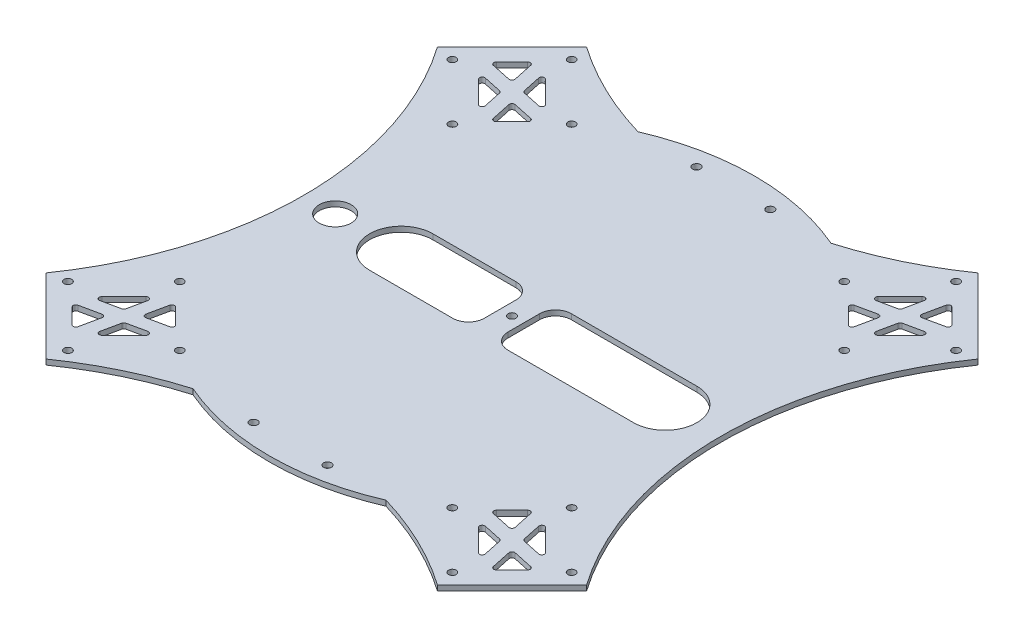
from build123d import *

# Parameters (mm, degrees)
EXTRUDE_1_DEPTH          = 2
HOLE_WIZARD_1_D          = 2.9
HOLE_WIZARD_1_DEPTH      = 100
CUT_EXTRUDE_2_DEPTH      = 146.013792447
CUT_EXTRUDE_2_DEPTH_BACK = 146.013792447
CUT_EXTRUDE_3_DEPTH      = 146.013792447
CUT_EXTRUDE_3_DEPTH_BACK = 146.013792447
SKETCH_8_R               = 129.444320441
CUT_EXTRUDE_4_DEPTH      = 146.013792447
CUT_EXTRUDE_4_DEPTH_BACK = 146.013792447
SKETCH_9_R               = 6.05
EXTRUDE_3_DEPTH          = 2
HOLE_WIZARD_2_D          = 3
HOLE_WIZARD_2_DEPTH      = 100
CUT_EXTRUDE_5_DEPTH      = 146.013792447
CUT_EXTRUDE_5_DEPTH_BACK = 146.013792447
SKETCH_18_R              = 1.5


with BuildPart() as part:
    # 草图1 → 凸台-拉伸1 (new body)
    with BuildSketch(Plane(origin=(0, 0, 0), x_dir=(1, 0, 0), z_dir=(0, 1, 0))):
        Polygon((-74.246212025, 102.530483272), (-102.530483272, 74.246212025), (-102.530483272, -74.246212025), (-74.246212025, -102.530483272), (74.246212025, -102.530483272), (102.530483272, -74.246212025), (102.530483272, 74.246212025), (74.246212025, 102.530483272), align=None)
    extrude(amount=EXTRUDE_1_DEPTH)

    # 孔1
    with Locations(Plane(origin=(0, 2, 0), x_dir=(1, 0, 0), z_dir=(0, 1, 0))):
        with Locations((-95.539712665, 72.915895741), (-74.326509229, 51.702692305), (-51.699092231, 74.330109303), (-72.912295667, 95.543312739), (72.915895741, 95.539712665), (51.702692305, 74.326509229), (74.330109303, 51.699092231), (95.543312739, 72.912295667), (95.539712665, -72.915895741), (74.326509229, -51.702692305), (51.699092231, -74.330109303), (72.912295667, -95.543312739), (-72.915895741, -95.539712665), (-51.702692305, -74.326509229), (-74.330109303, -51.699092231), (-95.543312739, -72.912295667)):
            Hole(HOLE_WIZARD_1_D / 2, depth=HOLE_WIZARD_1_DEPTH)

    # 草图7 → 切除-拉伸2 (cut, two sides: drawn at the far end of the back side and taken through both)
    with BuildSketch(Plane(origin=(0, 2, 0), x_dir=(1, 0, 0), z_dir=(0, 1, 0)).offset(-CUT_EXTRUDE_2_DEPTH_BACK)):
        with BuildLine():
            Line((-86.393024897, 80.484175463), (-80.480575389, 86.396624971))
            ThreePointArc((-80.480575389, 86.396624971), (-79.489849579, 86.64845523), (-78.795493206, 85.89823837))
            Line((-78.795493206, 85.89823837), (-77.191282416, 78.381578071))
            ThreePointArc((-77.191282416, 78.381578071), (-77.462151036, 77.46575111), (-78.377977997, 77.194882489))
            Line((-78.377977997, 77.194882489), (-85.894638296, 78.79909328))
            ThreePointArc((-85.894638296, 78.79909328), (-86.644855156, 79.493449653), (-86.393024897, 80.484175463))
        make_face()
        with BuildLine():
            Line((-84.160083838, 71.435761851), (-75.806643119, 63.082321131))
            ThreePointArc((-75.806643119, 63.082321131), (-74.622014392, 62.91080809), (-74.121560936, 63.998148093))
            Line((-74.121560936, 63.998148093), (-75.590793382, 70.882356366))
            ThreePointArc((-75.590793382, 70.882356366), (-75.861662002, 71.380742967), (-76.360048603, 71.651611588))
            Line((-76.360048603, 71.651611588), (-83.244256877, 73.120844034))
            ThreePointArc((-83.244256877, 73.120844034), (-84.331596879, 72.620390577), (-84.160083838, 71.435761851))
        make_face()
        with BuildLine():
            Line((-71.432161777, 84.163683912), (-63.078721058, 75.810243193))
            ThreePointArc((-63.078721058, 75.810243193), (-62.907208017, 74.625614466), (-63.994548019, 74.12516101))
            Line((-63.994548019, 74.12516101), (-70.878756293, 75.594393456))
            ThreePointArc((-70.878756293, 75.594393456), (-71.377142893, 75.865262076), (-71.648011514, 76.363648677))
            Line((-71.648011514, 76.363648677), (-73.11724396, 83.247856951))
            ThreePointArc((-73.11724396, 83.247856951), (-72.616790503, 84.335196953), (-71.432161777, 84.163683912))
        make_face()
        with BuildLine():
            Line((-66.758229507, 60.849380072), (-60.845779998, 66.761829581))
            ThreePointArc((-60.845779998, 66.761829581), (-60.59394974, 67.752555391), (-61.344166599, 68.446911764))
            Line((-61.344166599, 68.446911764), (-68.860826898, 70.051122554))
            ThreePointArc((-68.860826898, 70.051122554), (-69.77665386, 69.780253934), (-70.04752248, 68.864426972))
            Line((-70.04752248, 68.864426972), (-68.44331169, 61.347766673))
            ThreePointArc((-68.44331169, 61.347766673), (-67.748955317, 60.597549814), (-66.758229507, 60.849380072))
        make_face()
        with BuildLine():
            Line((80.484175463, 86.393024897), (86.396624971, 80.480575389))
            ThreePointArc((86.396624971, 80.480575389), (86.64845523, 79.489849579), (85.89823837, 78.795493206))
            Line((85.89823837, 78.795493206), (78.381578071, 77.191282416))
            ThreePointArc((78.381578071, 77.191282416), (77.46575111, 77.462151036), (77.194882489, 78.377977997))
            Line((77.194882489, 78.377977997), (78.79909328, 85.894638296))
            ThreePointArc((78.79909328, 85.894638296), (79.493449653, 86.644855156), (80.484175463, 86.393024897))
        make_face()
        with BuildLine():
            Line((71.435761851, 84.160083838), (63.082321131, 75.806643119))
            ThreePointArc((63.082321131, 75.806643119), (62.91080809, 74.622014392), (63.998148093, 74.121560936))
            Line((63.998148093, 74.121560936), (70.882356366, 75.590793382))
            ThreePointArc((70.882356366, 75.590793382), (71.380742967, 75.861662002), (71.651611588, 76.360048603))
            Line((71.651611588, 76.360048603), (73.120844034, 83.244256877))
            ThreePointArc((73.120844034, 83.244256877), (72.620390577, 84.331596879), (71.435761851, 84.160083838))
        make_face()
        with BuildLine():
            Line((84.163683912, 71.432161777), (75.810243193, 63.078721058))
            ThreePointArc((75.810243193, 63.078721058), (74.625614466, 62.907208017), (74.12516101, 63.994548019))
            Line((74.12516101, 63.994548019), (75.594393456, 70.878756293))
            ThreePointArc((75.594393456, 70.878756293), (75.865262076, 71.377142893), (76.363648677, 71.648011514))
            Line((76.363648677, 71.648011514), (83.247856951, 73.11724396))
            ThreePointArc((83.247856951, 73.11724396), (84.335196953, 72.616790503), (84.163683912, 71.432161777))
        make_face()
        with BuildLine():
            Line((60.849380072, 66.758229507), (66.761829581, 60.845779998))
            ThreePointArc((66.761829581, 60.845779998), (67.752555391, 60.59394974), (68.446911764, 61.344166599))
            Line((68.446911764, 61.344166599), (70.051122554, 68.860826898))
            ThreePointArc((70.051122554, 68.860826898), (69.780253934, 69.77665386), (68.864426972, 70.04752248))
            Line((68.864426972, 70.04752248), (61.347766673, 68.44331169))
            ThreePointArc((61.347766673, 68.44331169), (60.597549814, 67.748955317), (60.849380072, 66.758229507))
        make_face()
        with BuildLine():
            Line((86.393024897, -80.484175463), (80.480575389, -86.396624971))
            ThreePointArc((80.480575389, -86.396624971), (79.489849579, -86.64845523), (78.795493206, -85.89823837))
            Line((78.795493206, -85.89823837), (77.191282416, -78.381578071))
            ThreePointArc((77.191282416, -78.381578071), (77.462151036, -77.46575111), (78.377977997, -77.194882489))
            Line((78.377977997, -77.194882489), (85.894638296, -78.79909328))
            ThreePointArc((85.894638296, -78.79909328), (86.644855156, -79.493449653), (86.393024897, -80.484175463))
        make_face()
        with BuildLine():
            Line((84.160083838, -71.435761851), (75.806643119, -63.082321131))
            ThreePointArc((75.806643119, -63.082321131), (74.622014392, -62.91080809), (74.121560936, -63.998148093))
            Line((74.121560936, -63.998148093), (75.590793382, -70.882356366))
            ThreePointArc((75.590793382, -70.882356366), (75.861662002, -71.380742967), (76.360048603, -71.651611588))
            Line((76.360048603, -71.651611588), (83.244256877, -73.120844034))
            ThreePointArc((83.244256877, -73.120844034), (84.331596879, -72.620390577), (84.160083838, -71.435761851))
        make_face()
        with BuildLine():
            Line((71.432161777, -84.163683912), (63.078721058, -75.810243193))
            ThreePointArc((63.078721058, -75.810243193), (62.907208017, -74.625614466), (63.994548019, -74.12516101))
            Line((63.994548019, -74.12516101), (70.878756293, -75.594393456))
            ThreePointArc((70.878756293, -75.594393456), (71.377142893, -75.865262076), (71.648011514, -76.363648677))
            Line((71.648011514, -76.363648677), (73.11724396, -83.247856951))
            ThreePointArc((73.11724396, -83.247856951), (72.616790503, -84.335196953), (71.432161777, -84.163683912))
        make_face()
        with BuildLine():
            Line((66.758229507, -60.849380072), (60.845779998, -66.761829581))
            ThreePointArc((60.845779998, -66.761829581), (60.59394974, -67.752555391), (61.344166599, -68.446911764))
            Line((61.344166599, -68.446911764), (68.860826898, -70.051122554))
            ThreePointArc((68.860826898, -70.051122554), (69.77665386, -69.780253934), (70.04752248, -68.864426972))
            Line((70.04752248, -68.864426972), (68.44331169, -61.347766673))
            ThreePointArc((68.44331169, -61.347766673), (67.748955317, -60.597549814), (66.758229507, -60.849380072))
        make_face()
        with BuildLine():
            Line((-80.484175463, -86.393024897), (-86.396624971, -80.480575389))
            ThreePointArc((-86.396624971, -80.480575389), (-86.64845523, -79.489849579), (-85.89823837, -78.795493206))
            Line((-85.89823837, -78.795493206), (-78.381578071, -77.191282416))
            ThreePointArc((-78.381578071, -77.191282416), (-77.46575111, -77.462151036), (-77.194882489, -78.377977997))
            Line((-77.194882489, -78.377977997), (-78.79909328, -85.894638296))
            ThreePointArc((-78.79909328, -85.894638296), (-79.493449653, -86.644855156), (-80.484175463, -86.393024897))
        make_face()
        with BuildLine():
            Line((-71.435761851, -84.160083838), (-63.082321131, -75.806643119))
            ThreePointArc((-63.082321131, -75.806643119), (-62.91080809, -74.622014392), (-63.998148093, -74.121560936))
            Line((-63.998148093, -74.121560936), (-70.882356366, -75.590793382))
            ThreePointArc((-70.882356366, -75.590793382), (-71.380742967, -75.861662002), (-71.651611588, -76.360048603))
            Line((-71.651611588, -76.360048603), (-73.120844034, -83.244256877))
            ThreePointArc((-73.120844034, -83.244256877), (-72.620390577, -84.331596879), (-71.435761851, -84.160083838))
        make_face()
        with BuildLine():
            Line((-84.163683912, -71.432161777), (-75.810243193, -63.078721058))
            ThreePointArc((-75.810243193, -63.078721058), (-74.625614466, -62.907208017), (-74.12516101, -63.994548019))
            Line((-74.12516101, -63.994548019), (-75.594393456, -70.878756293))
            ThreePointArc((-75.594393456, -70.878756293), (-75.865262076, -71.377142893), (-76.363648677, -71.648011514))
            Line((-76.363648677, -71.648011514), (-83.247856951, -73.11724396))
            ThreePointArc((-83.247856951, -73.11724396), (-84.335196953, -72.616790503), (-84.163683912, -71.432161777))
        make_face()
        with BuildLine():
            Line((-60.849380072, -66.758229507), (-66.761829581, -60.845779998))
            ThreePointArc((-66.761829581, -60.845779998), (-67.752555391, -60.59394974), (-68.446911764, -61.344166599))
            Line((-68.446911764, -61.344166599), (-70.051122554, -68.860826898))
            ThreePointArc((-70.051122554, -68.860826898), (-69.780253934, -69.77665386), (-68.864426972, -70.04752248))
            Line((-68.864426972, -70.04752248), (-61.347766673, -68.44331169))
            ThreePointArc((-61.347766673, -68.44331169), (-60.597549814, -67.748955317), (-60.849380072, -66.758229507))
        make_face()
    extrude(amount=CUT_EXTRUDE_2_DEPTH + CUT_EXTRUDE_2_DEPTH_BACK, mode=Mode.SUBTRACT)

    # 草图8 → 切除-拉伸3 (cut, two sides: drawn at the far end of the back side and taken through both)
    with BuildSketch(Plane(origin=(0, 2, 0), x_dir=(1, 0, 0), z_dir=(0, 1, 0)).offset(-CUT_EXTRUDE_3_DEPTH_BACK)):
        with Locations((-208.565062983, 0)):
            Circle(SKETCH_8_R)
        with Locations((0, 208.565062983)):
            Circle(SKETCH_8_R)
        with Locations((208.565062983, 0)):
            Circle(SKETCH_8_R)
        with Locations((0, -208.565062983)):
            Circle(SKETCH_8_R)
    extrude(amount=CUT_EXTRUDE_3_DEPTH + CUT_EXTRUDE_3_DEPTH_BACK, mode=Mode.SUBTRACT)

    # 草图9 → 切除-拉伸4 (cut, two sides: drawn at the far end of the back side and taken through both)
    with BuildSketch(Plane(origin=(0, 2, 0), x_dir=(1, 0, 0), z_dir=(0, 1, 0)).offset(-CUT_EXTRUDE_4_DEPTH_BACK)):
        with Locations(Location((-67.070742542, 0, 0), (0, 0, 270))):
            Circle(SKETCH_9_R)
    extrude(amount=CUT_EXTRUDE_4_DEPTH + CUT_EXTRUDE_4_DEPTH_BACK, mode=Mode.SUBTRACT)

    # 草图15 → 凸台-拉伸3 (add)
    with BuildSketch(Plane(origin=(0, 2, 0), x_dir=(1, 0, 0), z_dir=(0, 1, 0))):
        with BuildLine():
            Line((-40.341181006, 82.683668974), (-31.918521189, 62.685196363))
            ThreePointArc((-31.918521189, 62.685196363), (2.489785707, 70.299550533), (36.273204046, 60.270063101))
            Line((36.273204046, 60.270063101), (44.635831637, 80.446519714))
            ThreePointArc((44.635831637, 80.446519714), (2.421201193, 91.968134616), (-40.341181006, 82.683668974))
        make_face()
        with BuildLine():
            Line((-42.42945176, -81.631743969), (-34.531619798, -61.284525552))
            ThreePointArc((-34.531619798, -61.284525552), (0.010434557, -70.343626073), (34.549799794, -61.274278226))
            Line((34.549799794, -61.274278226), (41.391005983, -82.163158555))
            ThreePointArc((41.391005983, -82.163158555), (-0.583260468, -91.998151108), (-42.42945176, -81.631743969))
        make_face()
    extrude(amount=-EXTRUDE_3_DEPTH)

    # 孔2
    with Locations(Plane(origin=(0, 2, 0), x_dir=(1, 0, 0), z_dir=(0, 1, 0))):
        with Locations((-14, 84), (14, 84), (-14, -84), (14, -84)):
            Hole(HOLE_WIZARD_2_D / 2, depth=HOLE_WIZARD_2_DEPTH)

    # 草图18 → 切除-拉伸5 (cut, two sides: drawn at the far end of the back side and taken through both)
    with BuildSketch(Plane(origin=(0, 2, 0), x_dir=(1, 0, 0), z_dir=(0, 1, 0)).offset(-CUT_EXTRUDE_5_DEPTH_BACK)):
        with Locations(Location((0, 0, 0), (0, 0, 270))):
            Circle(SKETCH_18_R)
        with BuildLine():
            Line((-42.020742542, 12), (-10.5, 12))
            ThreePointArc((-10.5, 12), (-6.257359313, 10.242640687), (-4.5, 6))
            Line((-4.5, 6), (-4.5, -6))
            ThreePointArc((-4.5, -6), (-6.257359313, -10.242640687), (-10.5, -12))
            Line((-10.5, -12), (-42.020742542, -12))
            ThreePointArc((-42.020742542, -12), (-54.020742542, 0), (-42.020742542, 12))
        make_face()
        with BuildLine():
            Line((10.5, -12), (58.120742542, -12))
            ThreePointArc((58.120742542, -12), (70.120742542, 0), (58.120742542, 12))
            Line((58.120742542, 12), (10.5, 12))
            ThreePointArc((10.5, 12), (6.257359313, 10.242640687), (4.5, 6))
            Line((4.5, 6), (4.5, -6))
            ThreePointArc((4.5, -6), (6.257359313, -10.242640687), (10.5, -12))
        make_face()
    extrude(amount=CUT_EXTRUDE_5_DEPTH + CUT_EXTRUDE_5_DEPTH_BACK, mode=Mode.SUBTRACT)


solid = part.part
